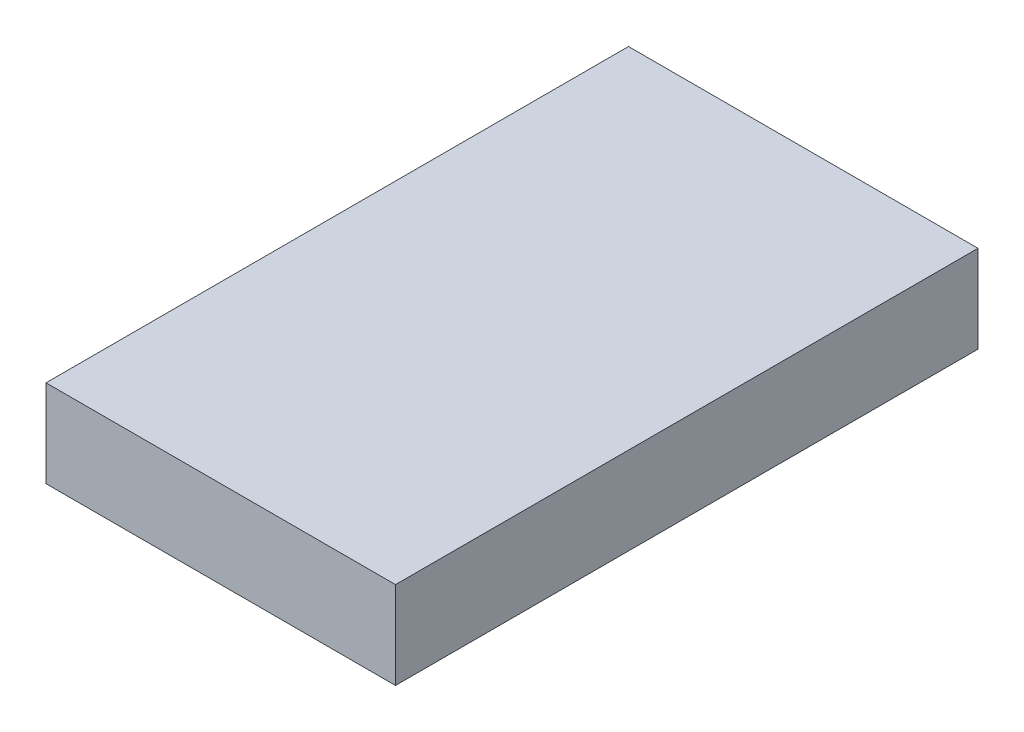
from build123d import *

# Parameters (mm, degrees)
BOSS_EXTRUDE2_DEPTH      = 300
BOSS_EXTRUDE2_DEPTH_BACK = 300
SKETCH1_W                = 150
SKETCH1_H                = 1000


with BuildPart() as part:
    # Sketch1 → Boss-Extrude2 (new, two sides: drawn at the far end of the back side and taken through both)
    with BuildSketch(Plane.YZ.offset(-BOSS_EXTRUDE2_DEPTH_BACK)):
        with Locations((75, 650)):
            Rectangle(SKETCH1_W, SKETCH1_H)
    extrude(amount=BOSS_EXTRUDE2_DEPTH + BOSS_EXTRUDE2_DEPTH_BACK)


solid = part.part
